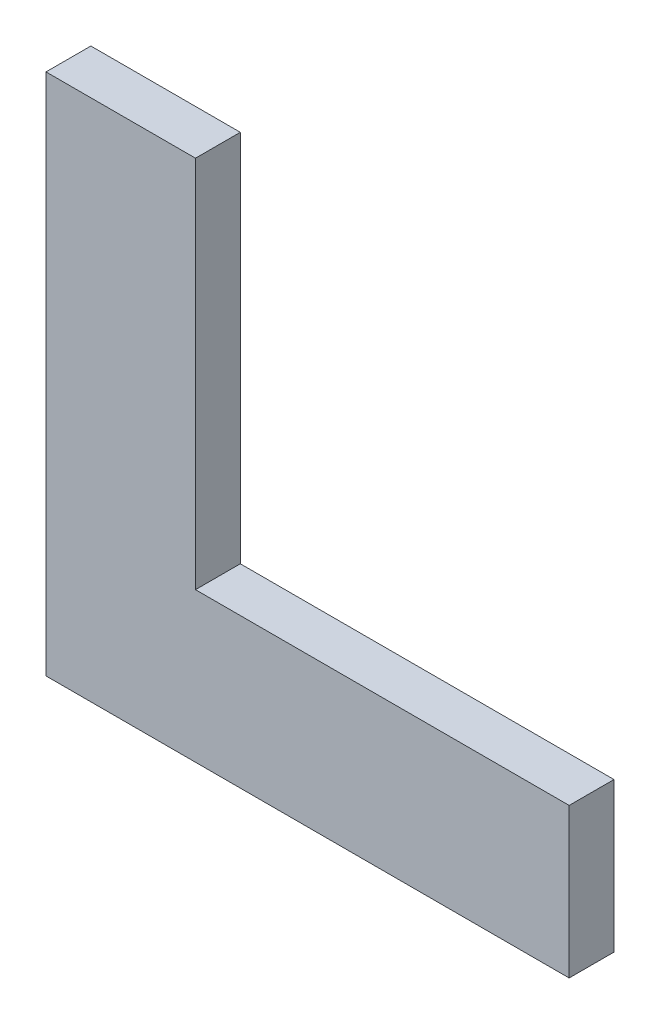
from build123d import *

# Parameters (mm, degrees)
BOSS_EXTRUDE1_DEPTH = 7.62


with BuildPart() as part:
    # Sketch1 → Boss-Extrude1 (new body)
    with BuildSketch(Plane.XY):
        Polygon((-31.604580153, 25.448473282), (-57.004580153, 25.448473282), (-57.004580153, -63.451526718), (31.895419847, -63.451526718), (31.895419847, -38.051526718), (-31.604580153, -38.051526718), align=None)
    extrude(amount=BOSS_EXTRUDE1_DEPTH)


solid = part.part
